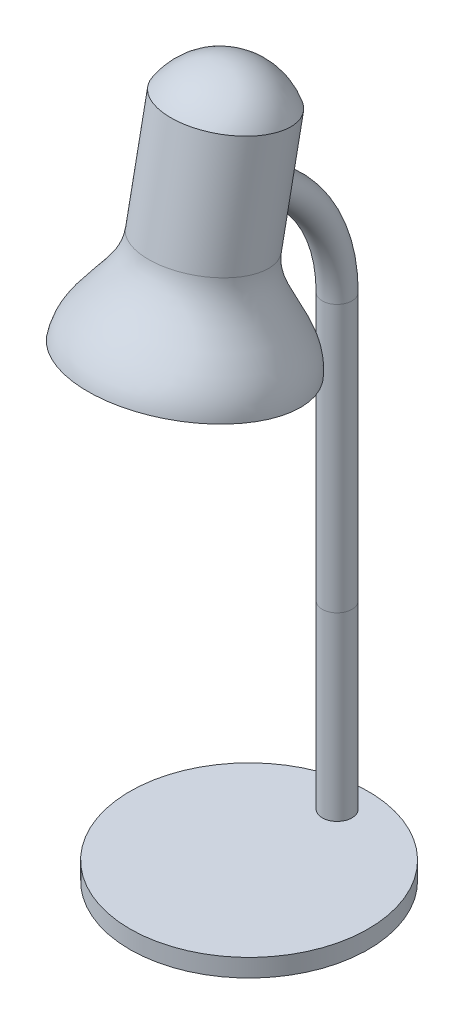
from build123d import *

# Parameters (mm, degrees)
SKETCH_2_R      = 100
EXTRUDE_1_DEPTH = 15
SKETCH_4_R      = 12.5


with BuildPart() as part:
    # 草图2 → 凸台-拉伸1 (new body)
    with BuildSketch(Plane(origin=(0, 0, 0), x_dir=(1, 0, 0), z_dir=(0, 1, 0))):
        with Locations(Location((0, 0, 0), (0, 0, 270))):
            Circle(SKETCH_2_R)
    extrude(amount=EXTRUDE_1_DEPTH)

    # 扫描1: sweep along a path in 草图3
    with BuildLine(Plane(origin=(0, 0, 0), x_dir=(0, 0, -1), z_dir=(1, 0, 0))) as sweep_1_path:
        Line((73.902769021, 15), (73.902769021, 166.562691704))
        Line((73.902769021, 166.562691704), (73.902769021, 390.709968379))
        ThreePointArc((73.902769021, 390.709968379), (44.192308228, 473.798889435), (-31.466612201, 519.210430284))
    # 草图4 → 扫描1 (sweep)
    with BuildSketch(Plane(origin=(0, 15, 0), x_dir=(1, 0, 0), z_dir=(0, 1, 0))):
        with Locations((0, 73.902769021)):
            Circle(SKETCH_4_R)
    sweep(path=sweep_1_path.line)

    # 草图6 → 旋转1 (revolve)
    with BuildSketch(Plane(origin=(0, 25.969403223, 129.999276708), x_dir=(1, 0, 0), z_dir=(0, 0.19589525539003017, 0.9806248257696085)), mode=Mode.PRIVATE) as revolve_1_sk:
        with BuildLine():
            Line((0, 388.498705936), (0, 591.59882287))
            ThreePointArc((0, 591.59882287), (27.426988969, 583.893568856), (46.828622065, 563.032425634))
            Line((46.828622065, 563.032425634), (46.828622065, 467.578854382))
            add(Edge.make_bspline(
                [(46.828622065, 467.578854382), (47.076936917, 435.310697465), (81.229684313, 420.22666255), (83.059174658, 388.498705936)],
                knots=[0, 0, 0, 0, 1, 1, 1, 1], degree=3))
            Line((83.059174658, 388.498705936), (0, 388.498705936))
        make_face()
    revolve(revolve_1_sk.sketch.rotate(Axis((0, 406.940879043, 53.89422349), (0, 0.9806248257696084, -0.19589525539003022)), 90), axis=Axis((0, 406.940879043, 53.89422349), (0, 0.9806248257696084, -0.19589525539003022)))


solid = part.part
